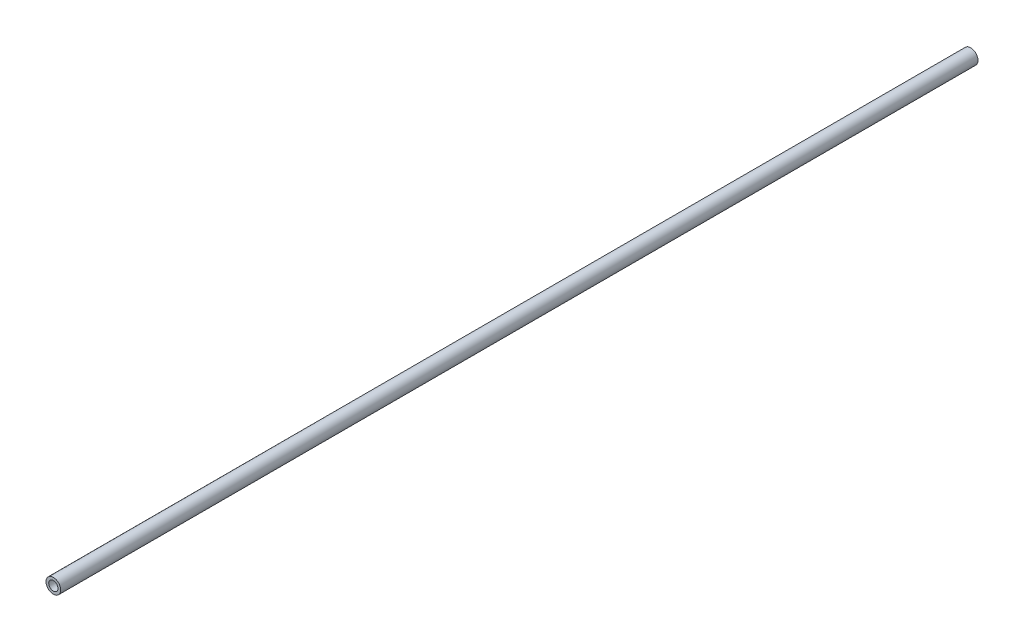
from build123d import *

# Parameters (mm, degrees)
SKETCH1_R           = 2.3876
SKETCH1_R_2         = 1.4986
BOSS_EXTRUDE1_DEPTH = 298.45


with BuildPart() as part:
    # Sketch1 → Boss-Extrude1 (new body)
    with BuildSketch(Plane.XY):
        Circle(SKETCH1_R)
        Circle(SKETCH1_R_2, mode=Mode.SUBTRACT)
    extrude(amount=BOSS_EXTRUDE1_DEPTH)


solid = part.part
